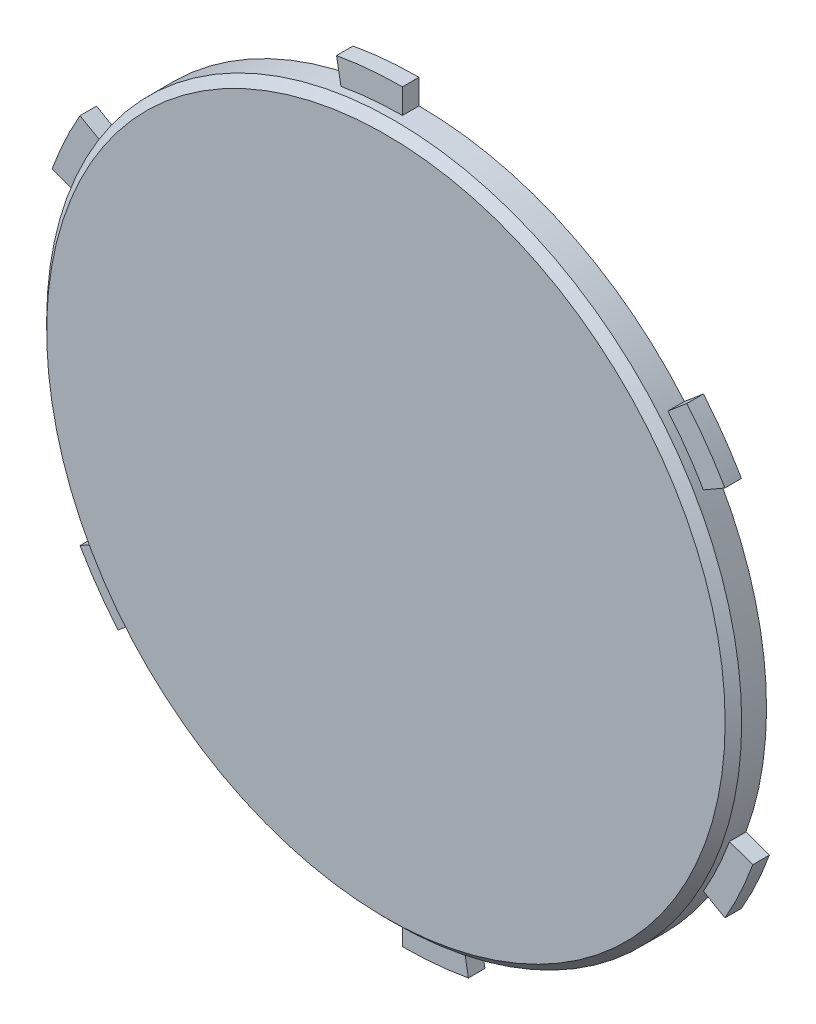
from build123d import *

# Parameters (mm, degrees)
SKETCH_1_R      = 21
EXTRUDE_1_DEPTH = 2
EXTRUDE_3_DEPTH = 1
CHAMFER_1_SIZE  = 0.5


with BuildPart() as part:
    # 草图1 → 凸台-拉伸1 (new body)
    with BuildSketch(Plane.XY):
        Circle(SKETCH_1_R)
    extrude(amount=EXTRUDE_1_DEPTH)

    # 草图3 → 凸台-拉伸3 (add)
    with BuildSketch(Plane(origin=(0, 0, 0), x_dir=(-1, 0, 0), z_dir=(0, 0, -1))):
        with BuildLine():
            Line((0, 22.5), (0, 21))
            ThreePointArc((0, 21), (1.866666667, 20.916872509), (3.718555113, 20.668148148))
            Line((3.718555113, 20.668148148), (3.984166192, 22.144444444))
            ThreePointArc((3.984166192, 22.144444444), (2, 22.410934831), (0, 22.5))
        make_face()
        with BuildLine():
            Line((19.485571585, 11.25), (18.186533479, 10.5))
            ThreePointArc((18.186533479, 10.5), (19.047876294, 8.841855501), (19.758418902, 7.113710881))
            Line((19.758418902, 7.113710881), (21.169734538, 7.621833087))
            ThreePointArc((21.169734538, 7.621833087), (20.408438886, 9.473416608), (19.485571585, 11.25))
        make_face()
        with BuildLine():
            Line((19.485571585, -11.25), (18.186533479, -10.5))
            ThreePointArc((18.186533479, -10.5), (17.181209627, -12.075017008), (16.039863789, -13.554437267))
            Line((16.039863789, -13.554437267), (17.185568345, -14.522611358))
            ThreePointArc((17.185568345, -14.522611358), (18.408438886, -12.937518223), (19.485571585, -11.25))
        make_face()
        with BuildLine():
            Line((0, -22.5), (0, -21))
            ThreePointArc((0, -21), (-1.866666667, -20.916872509), (-3.718555113, -20.668148148))
            Line((-3.718555113, -20.668148148), (-3.984166192, -22.144444444))
            ThreePointArc((-3.984166192, -22.144444444), (-2, -22.410934831), (0, -22.5))
        make_face()
        with BuildLine():
            Line((-19.485571585, -11.25), (-18.186533479, -10.5))
            ThreePointArc((-18.186533479, -10.5), (-19.047876294, -8.841855501), (-19.758418902, -7.113710881))
            Line((-19.758418902, -7.113710881), (-21.169734538, -7.621833087))
            ThreePointArc((-21.169734538, -7.621833087), (-20.408438886, -9.473416608), (-19.485571585, -11.25))
        make_face()
        with BuildLine():
            Line((-19.485571585, 11.25), (-18.186533479, 10.5))
            ThreePointArc((-18.186533479, 10.5), (-17.181209627, 12.075017008), (-16.039863789, 13.554437267))
            Line((-16.039863789, 13.554437267), (-17.185568345, 14.522611358))
            ThreePointArc((-17.185568345, 14.522611358), (-18.408438886, 12.937518223), (-19.485571585, 11.25))
        make_face()
    extrude(amount=-EXTRUDE_3_DEPTH)

    # 倒角1
    chamfer_1_edges = [part.edges().sort_by_distance(p)[0] for p in [
        (-21, 0, 2),
    ]]
    chamfer(chamfer_1_edges, length=CHAMFER_1_SIZE)


solid = part.part
